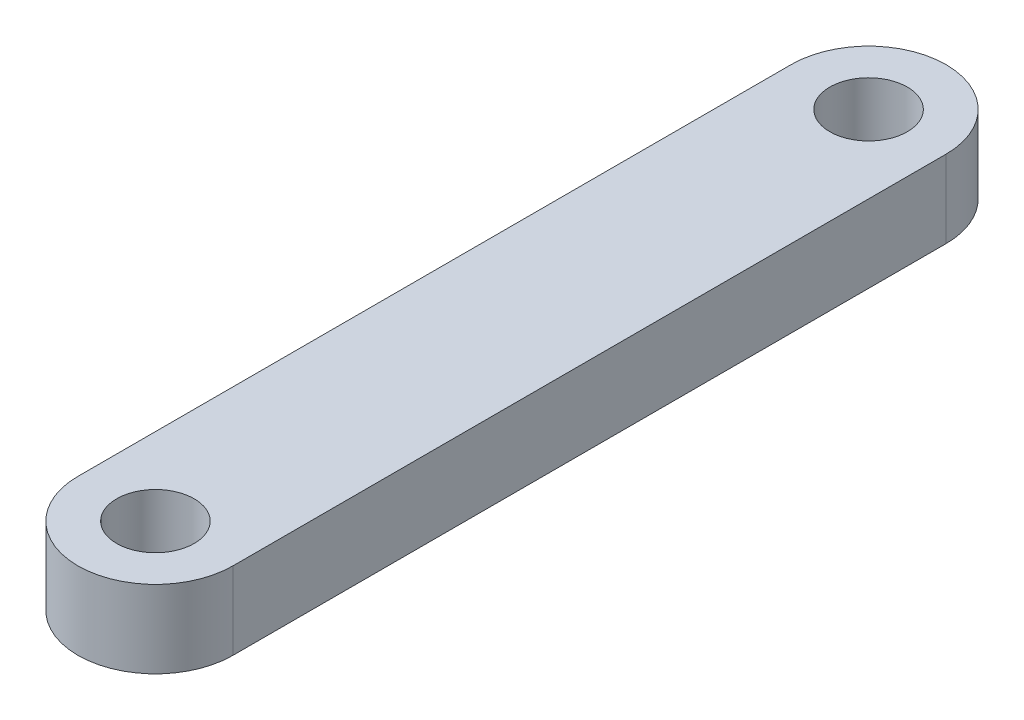
from build123d import *

# Parameters (mm, degrees)
SKETCH1_R           = 3.175
BOSS_EXTRUDE1_DEPTH = 3.175


with BuildPart() as part:
    # Sketch1 → Boss-Extrude1 (new, symmetric)
    with BuildSketch(Plane(origin=(0, 0, 0), x_dir=(1, 0, 0), z_dir=(0, 1, 0))):
        with BuildLine():
            Line((-6.35, -29.21), (-6.35, 29.21))
            ThreePointArc((-6.35, 29.21), (0, 35.56), (6.35, 29.21))
            Line((6.35, 29.21), (6.35, -29.21))
            ThreePointArc((6.35, -29.21), (0, -35.56), (-6.35, -29.21))
        make_face()
        with Locations(Location((0, 29.21, 0), (0, 0, 270))):
            Circle(SKETCH1_R, mode=Mode.SUBTRACT)
        with Locations(Location((0, -29.21, 0), (0, 0, 270))):
            Circle(SKETCH1_R, mode=Mode.SUBTRACT)
    extrude(amount=BOSS_EXTRUDE1_DEPTH, both=True)


solid = part.part
